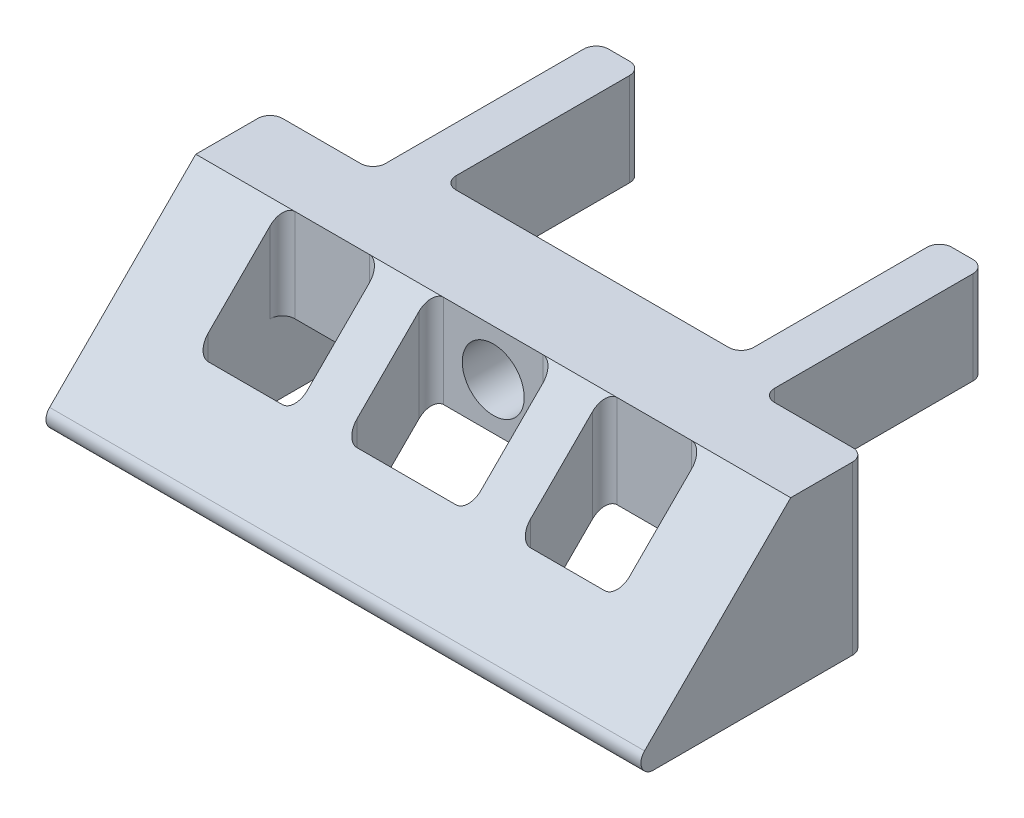
from build123d import *

# Parameters (mm, degrees)
BOSS_EXTRUDE2_DEPTH   = 7.5
BOSS_EXTRUDE3_DEPTH   = 48
BOSS_EXTRUDE4_DEPTH   = 7
CUT_EXTRUDE2_START    = -13.5
SKETCH4_W             = 8
SKETCH4_H             = 7
SKETCH4_W_2           = 10
CUT_EXTRUDE2_DEPTH    = 13.5
M6X1_0_TAPPED_HOLE4_D = 5
FILLET1_R             = 1


with BuildPart() as part:
    # Sketch1 → Boss-Extrude2 (new body)
    with BuildSketch(Plane(origin=(0, 0, 0), x_dir=(1, 0, 0), z_dir=(0, 1, 0))):
        Polygon((12, 24), (8.3, 24), (8.3, 6), (0, 6), (0, 0), (48, 0), (48, 6), (39.7, 6), (39.7, 24), (36, 24), (36, 8), (12, 8), align=None)
    extrude(amount=BOSS_EXTRUDE2_DEPTH)

    # Sketch3 → Boss-Extrude3 (add)
    with BuildSketch(Plane(origin=(48, 0, 0), x_dir=(0, 0, -1), z_dir=(1, 0, 0))):
        Polygon((0, 0), (-6, -6), (-13.5, -6), (0, 7.5), align=None)
    extrude(amount=-BOSS_EXTRUDE3_DEPTH)

    # Sketch16 → Boss-Extrude4 (add)
    with BuildSketch(Plane(origin=(48, 0, 0), x_dir=(0, 0, -1), z_dir=(1, 0, 0))):
        Polygon((-6, -6), (6, -6), (6, 0), (0, 0), align=None)
    boss_extrude4 = extrude(amount=-BOSS_EXTRUDE4_DEPTH)

    # Sketch4 → Cut-Extrude2 (cut)
    with BuildSketch(Plane.XZ.offset(6).offset(CUT_EXTRUDE2_START)):
        with Locations((11, 3.5)):
            Rectangle(SKETCH4_W, SKETCH4_H)
        with Locations((37, 3.5)):
            Rectangle(SKETCH4_W, SKETCH4_H)
        with Locations((24, 3.5)):
            Rectangle(SKETCH4_W_2, SKETCH4_H)
    extrude(amount=CUT_EXTRUDE2_DEPTH, mode=Mode.SUBTRACT)

    # M6x1.0 Tapped Hole4 (through all)
    with Locations(Plane(origin=(0, 0, -8), x_dir=(-1, 0, 0), z_dir=(0, 0, -1))):
        with Locations((-24, 3.75)):
            Hole(M6X1_0_TAPPED_HOLE4_D / 2)

    # Mirror1: Boss-Extrude4 across plane
    add(boss_extrude4.mirror(Plane.ZY.offset(-24)))

    # Fillet1
    fillet1_edges = [part.edges().sort_by_distance(p)[0] for p in [
        (29, 3.75, 0),
        (29, -2.75, 7),
        (19, -2.75, 7),
        (19, 3.75, 0),
        (7, -3, -6),
        (39.7, 3.75, -24),
        (39.7, 3.75, -6),
        (48, 0.75, -6),
        (0, 0.75, -6),
        (8.3, 3.75, -6),
        (8.3, 3.75, -24),
        (12, 3.75, -24),
        (12, 3.75, -8),
        (36, 3.75, -8),
        (36, 3.75, -24),
        (24, -6, 13.5),
        (41, -3, -6),
        (15, 3.75, 0),
        (15, -2.75, 7),
        (7, -2.75, 7),
        (7, 3.75, 0),
        (33, -2.75, 7),
        (33, 3.75, 0),
        (41, 3.75, 0),
        (41, -2.75, 7),
    ]]
    fillet(fillet1_edges, radius=FILLET1_R)


solid = part.part
